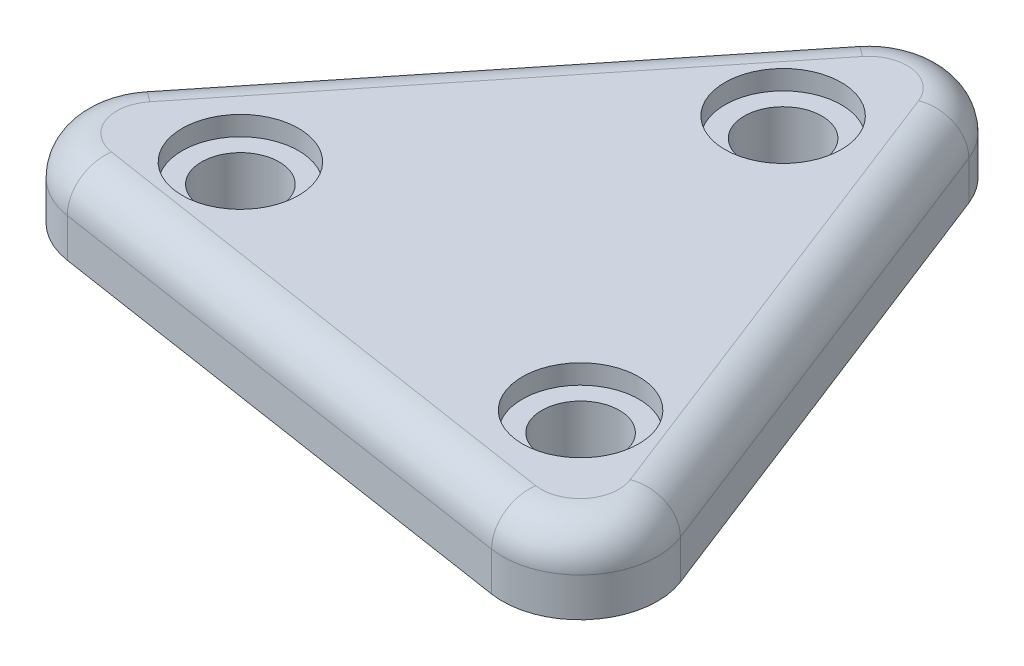
from build123d import *

# Parameters (mm, degrees)
SKETCH1_R           = 1
BOSS_EXTRUDE1_DEPTH = 2
FILLET1_R           = 2
FILLET2_R           = 1
SKETCH2_R           = 1.5
CUT_EXTRUDE1_DEPTH  = 0.5


with BuildPart() as part:
    # Sketch1 → Boss-Extrude1 (new body)
    with BuildSketch(Plane(origin=(0, 0, 0), x_dir=(1, 0, 0), z_dir=(0, 1, 0))):
        Polygon((1.750249519, 11.413586639), (-10.759580737, -4.191032773), (9.009331218, -7.222553866), align=None)
        with Locations(Location((0.670392162, 5.734449205, 0), (0, 0, 270))):
            Circle(SKETCH1_R, mode=Mode.SUBTRACT)
        with Locations(Location((4.630982607, -3.447801245, 0), (0, 0, 270))):
            Circle(SKETCH1_R, mode=Mode.SUBTRACT)
        with Locations(Location((-5.301374769, -2.28664796, 0), (0, 0, 270))):
            Circle(SKETCH1_R, mode=Mode.SUBTRACT)
    extrude(amount=BOSS_EXTRUDE1_DEPTH)

    # Fillet1
    fillet1_edges = [part.edges().sort_by_distance(p)[0] for p in [
        (9.009331218, 1, 7.222553866),
        (-10.759580737, 1, 4.191032773),
        (1.750249519, 1, -11.413586639),
    ]]
    fillet(fillet1_edges, radius=FILLET1_R)

    # Fillet2
    fillet2_edges = [part.edges().sort_by_distance(p)[0] for p in [
        (-4.504665609, 2, -3.611276933),
        (5.379790368, 2, -2.095516386),
        (-0.875124759, 2, 5.706793319),
        (-8.895966686, 2, 3.465124603),
        (7.448869277, 2, 5.97157084),
        (1.44709741, 2, -9.436695443),
    ]]
    fillet(fillet2_edges, radius=FILLET2_R)

    # Sketch2 → Cut-Extrude1 (cut)
    with BuildSketch(Plane(origin=(0, 2, 0), x_dir=(1, 0, 0), z_dir=(0, 1, 0))):
        with Locations(Location((0.670392162, 5.734449205, 0), (0, 0, 270))):
            Circle(SKETCH2_R)
        with Locations(Location((-5.301374769, -2.28664796, 0), (0, 0, 270))):
            Circle(SKETCH2_R)
        with Locations(Location((4.630982607, -3.447801245, 0), (0, 0, 270))):
            Circle(SKETCH2_R)
    extrude(amount=-CUT_EXTRUDE1_DEPTH, mode=Mode.SUBTRACT)


solid = part.part
